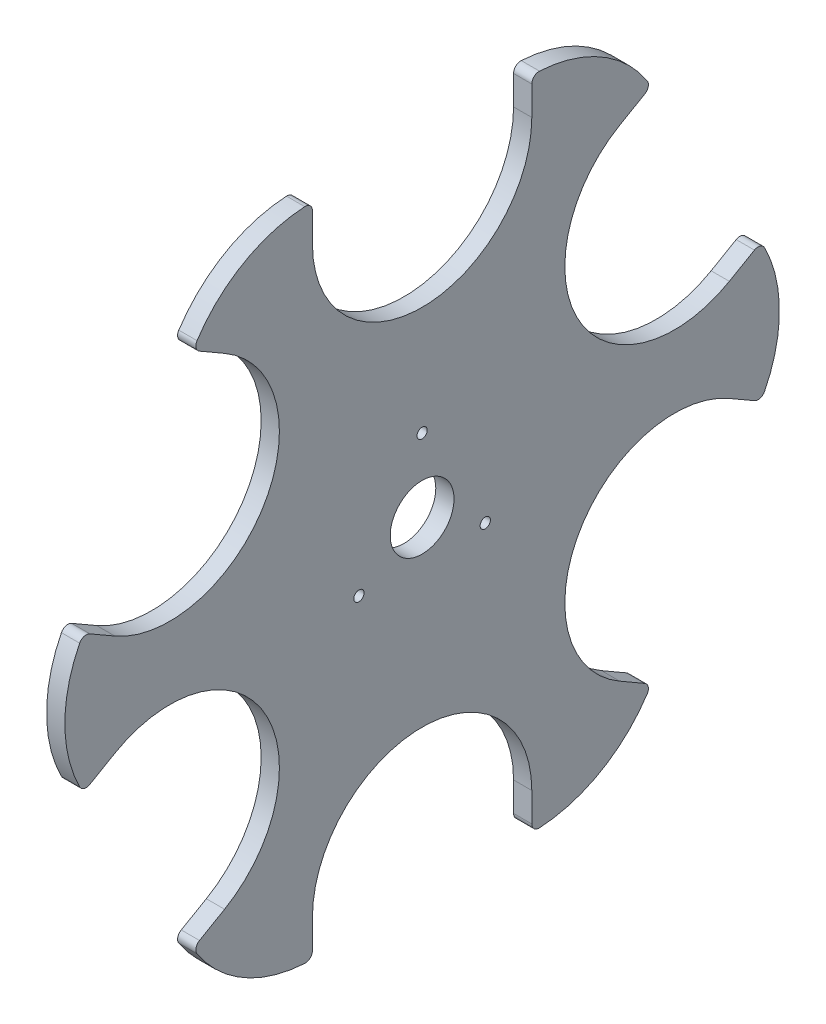
from build123d import *

# Parameters (mm, degrees)
SKETCH1_R                       = 11.110595
BOSS_EXTRUDE1_DEPTH             = 6.35
F_9_64_0_14063_DIAMETER_HOLE1_D = 3.572002
CIRPATTERN1_COUNT               = 3
FILLET1_R                       = 2.54


with BuildPart() as part:
    # Sketch1 → Boss-Extrude1 (new body)
    with BuildSketch(Plane(origin=(0, 0, 0), x_dir=(0, 0, -1), z_dir=(1, 0, 0))):
        with BuildLine():
            Line((68.801578457, 83.832170471), (79.800101085, 90.182170471))
            ThreePointArc((79.800101085, 90.182170471), (62.217829583, 107.764441974), (38.200000054, 114.2))
            Line((38.200000054, 114.2), (38.200000054, 101.5))
            ThreePointArc((38.200000054, 101.5), (0, 63.299999946), (-38.200000054, 101.5))
            Line((-38.200000054, 101.5), (-38.200000054, 114.2))
            ThreePointArc((-38.200000054, 114.2), (-62.217829583, 107.764441974), (-79.800101085, 90.182170471))
            Line((-79.800101085, 90.182170471), (-68.801578457, 83.832170471))
            ThreePointArc((-68.801578457, 83.832170471), (-54.819408013, 31.649999973), (-107.001578511, 17.667829529))
            Line((-107.001578511, 17.667829529), (-118.000101139, 24.017829529))
            ThreePointArc((-118.000101139, 24.017829529), (-124.435659165, 0), (-118.000101139, -24.017829529))
            Line((-118.000101139, -24.017829529), (-107.001578511, -17.667829529))
            ThreePointArc((-107.001578511, -17.667829529), (-54.819408013, -31.649999973), (-68.801578457, -83.832170471))
            Line((-68.801578457, -83.832170471), (-79.800101085, -90.182170471))
            ThreePointArc((-79.800101085, -90.182170471), (-62.217829583, -107.764441974), (-38.200000054, -114.2))
            Line((-38.200000054, -114.2), (-38.200000054, -101.5))
            ThreePointArc((-38.200000054, -101.5), (0, -63.299999946), (38.200000054, -101.5))
            Line((38.200000054, -101.5), (38.200000054, -114.2))
            ThreePointArc((38.200000054, -114.2), (62.217829583, -107.764441974), (79.800101085, -90.182170471))
            Line((79.800101085, -90.182170471), (68.801578457, -83.832170471))
            ThreePointArc((68.801578457, -83.832170471), (54.819408013, -31.649999973), (107.001578511, -17.667829529))
            Line((107.001578511, -17.667829529), (118.000101139, -24.017829529))
            ThreePointArc((118.000101139, -24.017829529), (124.435659165, 0), (118.000101139, 24.017829529))
            Line((118.000101139, 24.017829529), (107.001578511, 17.667829529))
            ThreePointArc((107.001578511, 17.667829529), (54.819408013, 31.649999973), (68.801578457, 83.832170471))
        make_face()
        Circle(SKETCH1_R, mode=Mode.SUBTRACT)
    extrude(amount=BOSS_EXTRUDE1_DEPTH)

    # 9/64 (0.14063) Diameter Hole1 (through all)
    with Locations(Plane(origin=(6.35, 0, 0), x_dir=(0, 0, -1), z_dir=(1, 0, 0))):
        with Locations((0, 25.4)):
            f_9_64_0_14063_diameter_hole1 = Hole(F_9_64_0_14063_DIAMETER_HOLE1_D / 2)

    # CirPattern1: 9/64 (0.14063) Diameter Hole1 ×3 about axis
    cirpattern1_axis = Axis((0, 0, 0), (1, 0, 0))
    for i in range(1, CIRPATTERN1_COUNT):
        add(f_9_64_0_14063_diameter_hole1.rotate(cirpattern1_axis, i * 360 / CIRPATTERN1_COUNT), mode=Mode.SUBTRACT)

    # Fillet1
    fillet1_edges = [part.edges().sort_by_distance(p)[0] for p in [
        (3.175, 114.2, -38.200000054),
        (3.175, 90.182170471, -79.800101085),
        (3.175, 24.017829529, -118.000101139),
        (3.175, -24.017829529, -118.000101139),
        (3.175, -90.182170471, -79.800101085),
        (3.175, -114.2, -38.200000054),
        (3.175, -114.2, 38.200000054),
        (3.175, -90.182170471, 79.800101085),
        (3.175, -24.017829529, 118.000101139),
        (3.175, 24.017829529, 118.000101139),
        (3.175, 90.182170471, 79.800101085),
        (3.175, 114.2, 38.200000054),
    ]]
    fillet(fillet1_edges, radius=FILLET1_R)


solid = part.part
